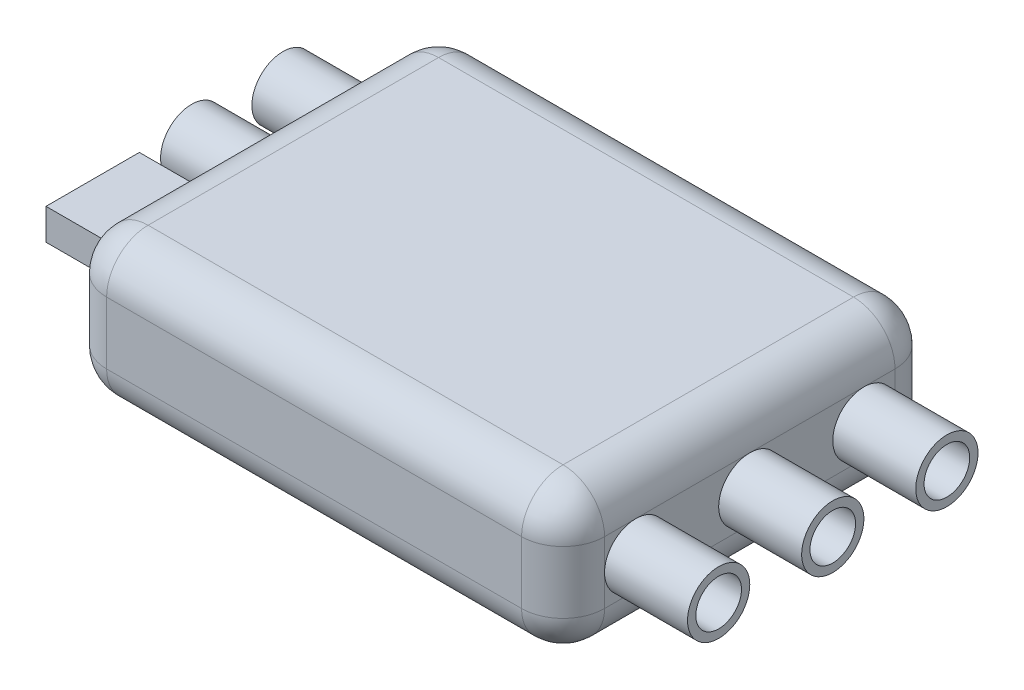
from build123d import *

# Parameters (mm, degrees)
BOSS_EXTRUDE1_DEPTH = 7
FILLET1_R           = 2
SKETCH3_R           = 1.5
SKETCH3_R_2         = 1.1
BOSS_EXTRUDE2_DEPTH = 4
BOSS_EXTRUDE3_START = 4
SKETCH4_R           = 1.5
SKETCH4_R_2         = 1.1
SKETCH4_W           = 4.5
SKETCH4_H           = 1.5
BOSS_EXTRUDE3_DEPTH = 4


with BuildPart() as part:
    # Sketch2 → Boss-Extrude1 (new body)
    with BuildSketch(Plane(origin=(0, 0, 0), x_dir=(1, 0, 0), z_dir=(0, 1, 0))):
        with BuildLine():
            Line((-10, 9), (10, 9))
            ThreePointArc((10, 9), (11.414213562, 8.414213562), (12, 7))
            Line((12, 7), (12, -7))
            ThreePointArc((12, -7), (11.414213562, -8.414213562), (10, -9))
            Line((10, -9), (-10, -9))
            ThreePointArc((-10, -9), (-11.414213562, -8.414213562), (-12, -7))
            Line((-12, -7), (-12, 7))
            ThreePointArc((-12, 7), (-11.414213562, 8.414213562), (-10, 9))
        make_face()
    extrude(amount=BOSS_EXTRUDE1_DEPTH)

    # Fillet1
    fillet1_edges = [part.edges().sort_by_distance(p)[0] for p in [
        (-12, 0, 0),
        (-11.414213562, 0, -8.414213562),
        (0, 0, -9),
        (11.414213562, 0, -8.414213562),
        (-11.414213562, 7, -8.414213562),
        (-12, 7, 0),
        (-11.414213562, 7, 8.414213562),
        (0, 7, 9),
        (11.414213562, 7, 8.414213562),
        (12, 7, 0),
        (11.414213562, 7, -8.414213562),
        (12, 0, 0),
        (0, 7, -9),
        (11.414213562, 0, 8.414213562),
        (0, 0, 9),
        (-11.414213562, 0, 8.414213562),
    ]]
    fillet(fillet1_edges, radius=FILLET1_R)

    # Sketch3 → Boss-Extrude2 (add)
    # profile 1 of 3: a face of its own
    with BuildSketch(Plane(origin=(12, 0, 0), x_dir=(0, 0, -1), z_dir=(1, 0, 0))):
        with Locations(Location((0, 3.5, 0), (0, 0, 270))):
            Circle(SKETCH3_R)
        with Locations((0, 3.5)):
            Circle(SKETCH3_R_2, mode=Mode.SUBTRACT)
    # profile 2 of 3: a face of its own
    with BuildSketch(Plane(origin=(12, 0, 0), x_dir=(0, 0, -1), z_dir=(1, 0, 0))):
        with Locations(Location((-5.5, 3.5, 0), (0, 0, 180))):
            Circle(SKETCH3_R)
        with Locations((-5.5, 3.5)):
            Circle(SKETCH3_R_2, mode=Mode.SUBTRACT)
    # profile 3 of 3: a face of its own
    with BuildSketch(Plane(origin=(12, 0, 0), x_dir=(0, 0, -1), z_dir=(1, 0, 0))):
        with Locations((5.5, 3.5)):
            Circle(SKETCH3_R)
        with Locations((5.5, 3.5)):
            Circle(SKETCH3_R_2, mode=Mode.SUBTRACT)
    extrude(amount=BOSS_EXTRUDE2_DEPTH)

    # Sketch4 → Boss-Extrude3 (add)
    # profile 1 of 3: a face of its own
    with BuildSketch(Plane.ZY.offset(12).offset(BOSS_EXTRUDE3_START)):
        with Locations(Location((-5.5, 3.5, 0), (0, 0, 180))):
            Circle(SKETCH4_R)
        with Locations(Location((-5.5, 3.5, 0), (0, 0, 180))):
            Circle(SKETCH4_R_2, mode=Mode.SUBTRACT)
    # profile 2 of 3: a face of its own
    with BuildSketch(Plane.ZY.offset(12).offset(BOSS_EXTRUDE3_START)):
        with Locations(Location((-1.1, 3.5, 0), (0, 0, 270))):
            Circle(SKETCH4_R)
        with Locations((-1.1, 3.5)):
            Circle(SKETCH4_R_2, mode=Mode.SUBTRACT)
    # profile 3 of 3: a face of its own
    with BuildSketch(Plane.ZY.offset(12).offset(BOSS_EXTRUDE3_START)):
        with Locations((3.671792116, 3.5)):
            Rectangle(SKETCH4_W, SKETCH4_H)
    extrude(amount=-BOSS_EXTRUDE3_DEPTH)


solid = part.part
